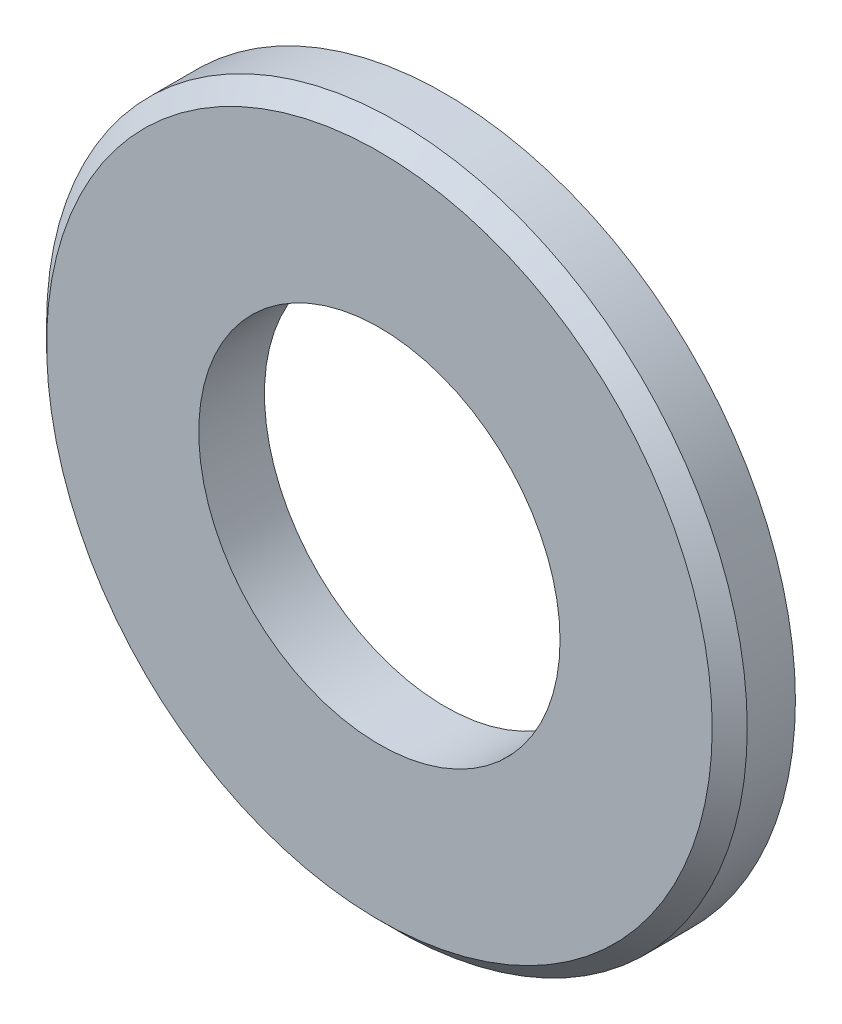
from build123d import *

# Parameters (mm, degrees)
SKETCH_1_R        = 16
SKETCH_1_R_2      = 8.25
EXTRUDE_230_DEPTH = 3
CHAMFER_1_SIZE    = 0.8


with BuildPart() as part:
    # Эскиз1 → Extrude 230 (new body)
    with BuildSketch(Plane.XY):
        with Locations((10.928233517, 3.972678648)):
            Circle(SKETCH_1_R)
        with Locations((10.928233517, 3.972678648)):
            Circle(SKETCH_1_R_2, mode=Mode.SUBTRACT)
    extrude(amount=EXTRUDE_230_DEPTH)

    # Фаска1
    chamfer_1_edges = [part.edges().sort_by_distance(p)[0] for p in [
        (-5.071766483, 3.972678648, 3),
    ]]
    chamfer(chamfer_1_edges, length=CHAMFER_1_SIZE)


solid = part.part
